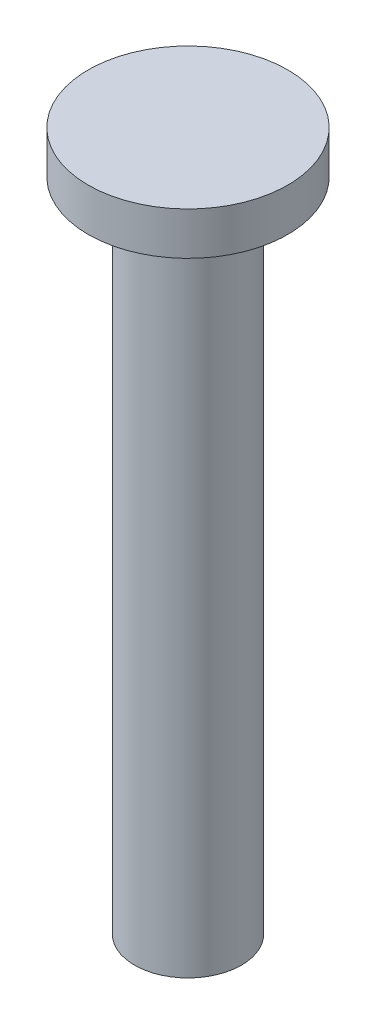
from build123d import *


with BuildPart() as part:
    # Sketch2 → Revolve1 (revolve)
    with BuildSketch(Plane.XY, mode=Mode.PRIVATE) as revolve1_sk:
        Polygon((0, 0), (0, 24.5), (3.5, 24.5), (3.5, 23), (1.875, 23), (1.875, 0), align=None)
    revolve(revolve1_sk.sketch.rotate(Axis((0, 0, 0), (0, 1, 0)), 90), axis=Axis((0, 0, 0), (0, 1, 0)))


solid = part.part
